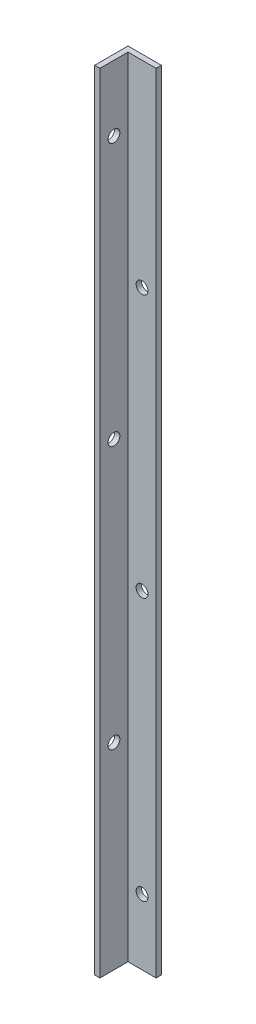
from build123d import *

# Parameters (mm, degrees)
BOSS_EXTRUDE1_DEPTH = 300
SKETCH2_R           = 2.25
CUT_EXTRUDE1_DEPTH  = 10
SKETCH3_R           = 2.25
CUT_EXTRUDE2_DEPTH  = 10


with BuildPart() as part:
    # Sketch1 → Boss-Extrude1 (new body)
    with BuildSketch(Plane(origin=(0, 0, 0), x_dir=(1, 0, 0), z_dir=(0, 1, 0))):
        Polygon((0, 0), (0, -12.7), (2, -12.7), (2, -2), (12.7, -2), (12.7, 0), align=None)
    extrude(amount=BOSS_EXTRUDE1_DEPTH)

    # Sketch2 → Cut-Extrude1 (cut)
    with BuildSketch(Plane(origin=(2, 0, 0), x_dir=(0, 0, -1), z_dir=(1, 0, 0))):
        with Locations((-7.35, 275)):
            Circle(SKETCH2_R)
        with Locations((-7.35, 175)):
            Circle(SKETCH2_R)
        with Locations((-7.35, 75)):
            Circle(SKETCH2_R)
    extrude(amount=-CUT_EXTRUDE1_DEPTH, mode=Mode.SUBTRACT)

    # Sketch3 → Cut-Extrude2 (cut)
    with BuildSketch(Plane.XY.offset(2)):
        with Locations((7.35, 225)):
            Circle(SKETCH3_R)
        with Locations((7.35, 125)):
            Circle(SKETCH3_R)
        with Locations((7.35, 25)):
            Circle(SKETCH3_R)
    extrude(amount=-CUT_EXTRUDE2_DEPTH, mode=Mode.SUBTRACT)


solid = part.part
